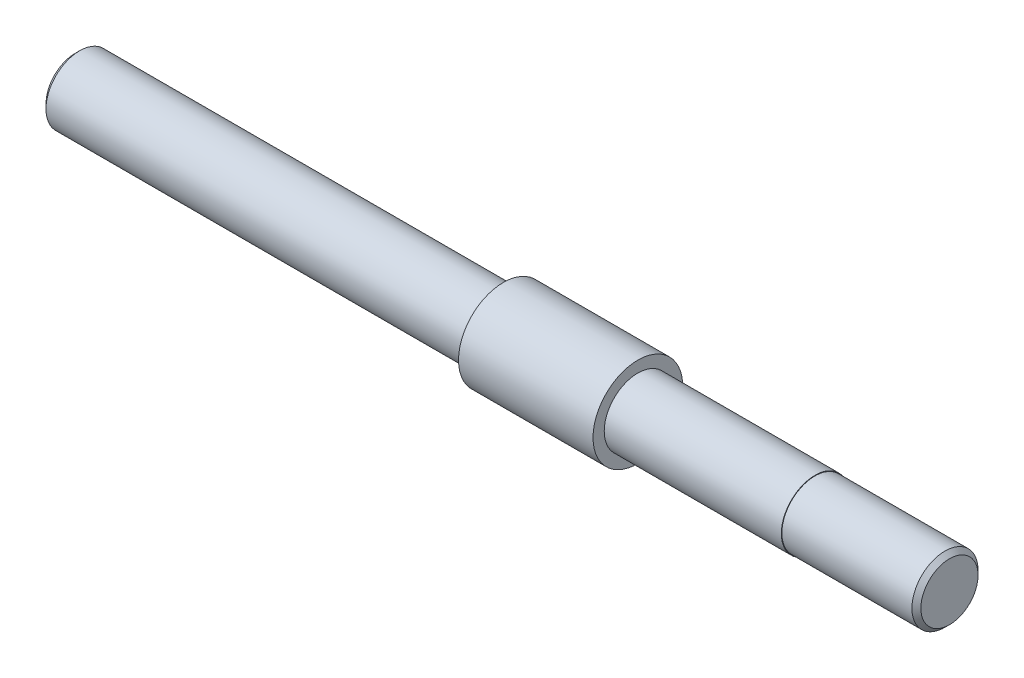
from build123d import *

# Parameters (mm, degrees)
CHAMFER_1_SIZE = 0.2


with BuildPart() as part:
    # 草图1 → 旋转1 (revolve)
    with BuildSketch(Plane.XY, mode=Mode.PRIVATE) as revolve_1_sk:
        Polygon((0, 0), (0, 1.475), (-6, 1.475), (-6, 1.5), (-13.9, 1.5), (-13.9, 2), (-19.9, 2), (-19.9, 1.5), (-39, 1.5), (-39, 0), align=None)
    revolve(revolve_1_sk.sketch.rotate(Axis((-12.088767593, 0, 0), (1, 0, 0)), 90), axis=Axis((-12.088767593, 0, 0), (1, 0, 0)))

    # 倒角1
    chamfer_1_edges = [part.edges().sort_by_distance(p)[0] for p in [
        (0, 0, -1.475),
        (-39, 0, -1.5),
    ]]
    chamfer(chamfer_1_edges, length=CHAMFER_1_SIZE)


solid = part.part
